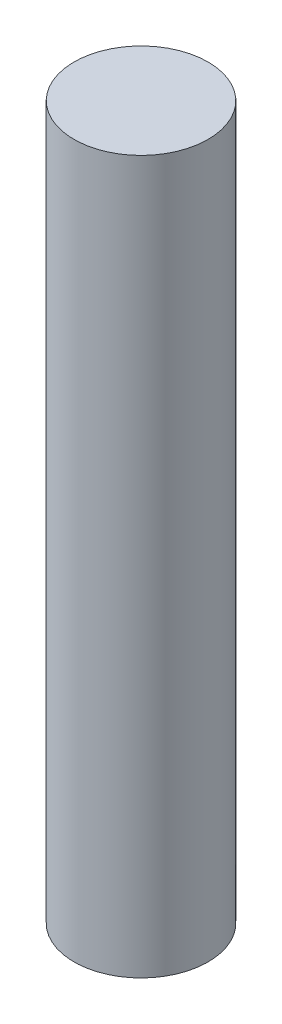
from build123d import *

# Parameters (mm, degrees)
SKETCH1_W = 112
SKETCH1_H = 1190


with BuildPart() as part:
    # Sketch1 → Revolve1 (revolve)
    with BuildSketch(Plane.XY, mode=Mode.PRIVATE) as revolve1_sk:
        with Locations((56, 595)):
            Rectangle(SKETCH1_W, SKETCH1_H)
    revolve(revolve1_sk.sketch.rotate(Axis((0, -226.14460276, 0), (0, 1, 0)), 90), axis=Axis((0, -226.14460276, 0), (0, 1, 0)))


solid = part.part
